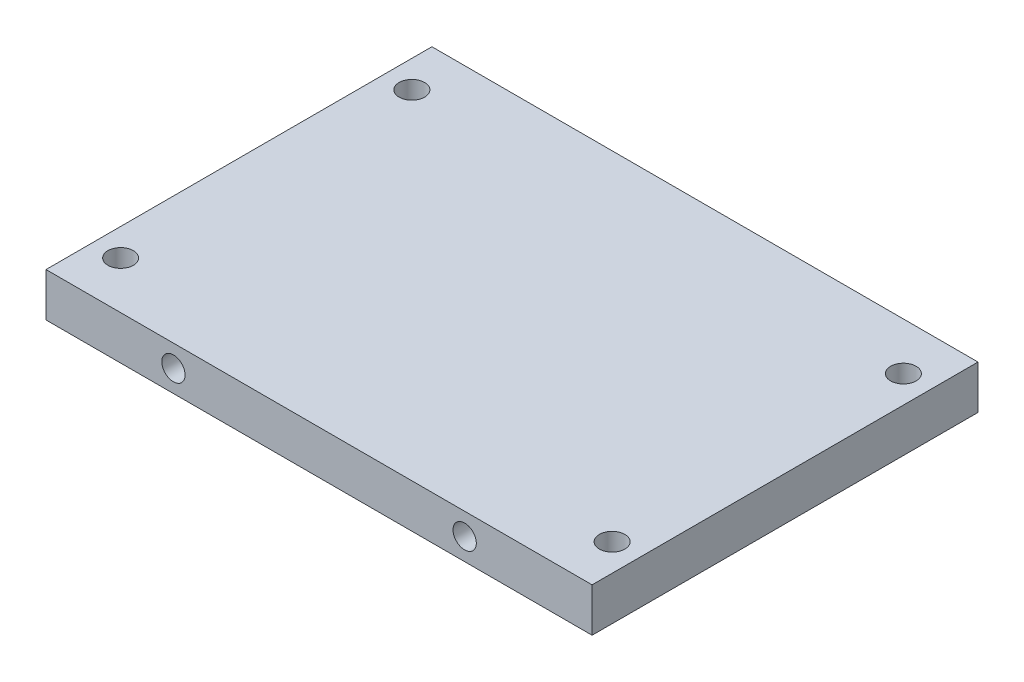
from build123d import *

# Parameters (mm, degrees)
SKETCH1_W           = 75
SKETCH1_H           = 53
SKETCH1_R           = 1.75
BOSS_EXTRUDE8_DEPTH = 6
SKETCH8_R           = 1.6
CUT_EXTRUDE1_DEPTH  = 10
CUT_EXTRUDE2_START  = -43
SKETCH8_3_R         = 1.6
CUT_EXTRUDE2_DEPTH  = 10


with BuildPart() as part:
    # Sketch1 → Boss-Extrude8 (new body)
    with BuildSketch(Plane(origin=(0, 0, 0), x_dir=(1, 0, 0), z_dir=(0, 1, 0))):
        with Locations((37.5, -26.5)):
            Rectangle(SKETCH1_W, SKETCH1_H)
        with Locations(Location((71.25, -6.5, 0), (0, 0, 270))):
            Circle(SKETCH1_R, mode=Mode.SUBTRACT)
        with Locations(Location((3.75, -6.5, 0), (0, 0, 270))):
            Circle(SKETCH1_R, mode=Mode.SUBTRACT)
        with Locations(Location((71.25, -46.5, 0), (0, 0, 270))):
            Circle(SKETCH1_R, mode=Mode.SUBTRACT)
        with Locations(Location((3.75, -46.5, 0), (0, 0, 270))):
            Circle(SKETCH1_R, mode=Mode.SUBTRACT)
    extrude(amount=BOSS_EXTRUDE8_DEPTH)

    # Sketch8 → Cut-Extrude1 (cut)
    with BuildSketch(Plane.XY.offset(53)):
        with Locations((17.5, 3)):
            Circle(SKETCH8_R)
        with Locations((57.5, 3)):
            Circle(SKETCH8_R)
    extrude(amount=-CUT_EXTRUDE1_DEPTH, mode=Mode.SUBTRACT)

    # Sketch8<3> → Cut-Extrude2 (cut)
    with BuildSketch(Plane.XY.offset(53).offset(CUT_EXTRUDE2_START)):
        with Locations((17.5, 3)):
            Circle(SKETCH8_3_R)
        with Locations((57.5, 3)):
            Circle(SKETCH8_3_R)
    extrude(amount=-CUT_EXTRUDE2_DEPTH, mode=Mode.SUBTRACT)


solid = part.part
